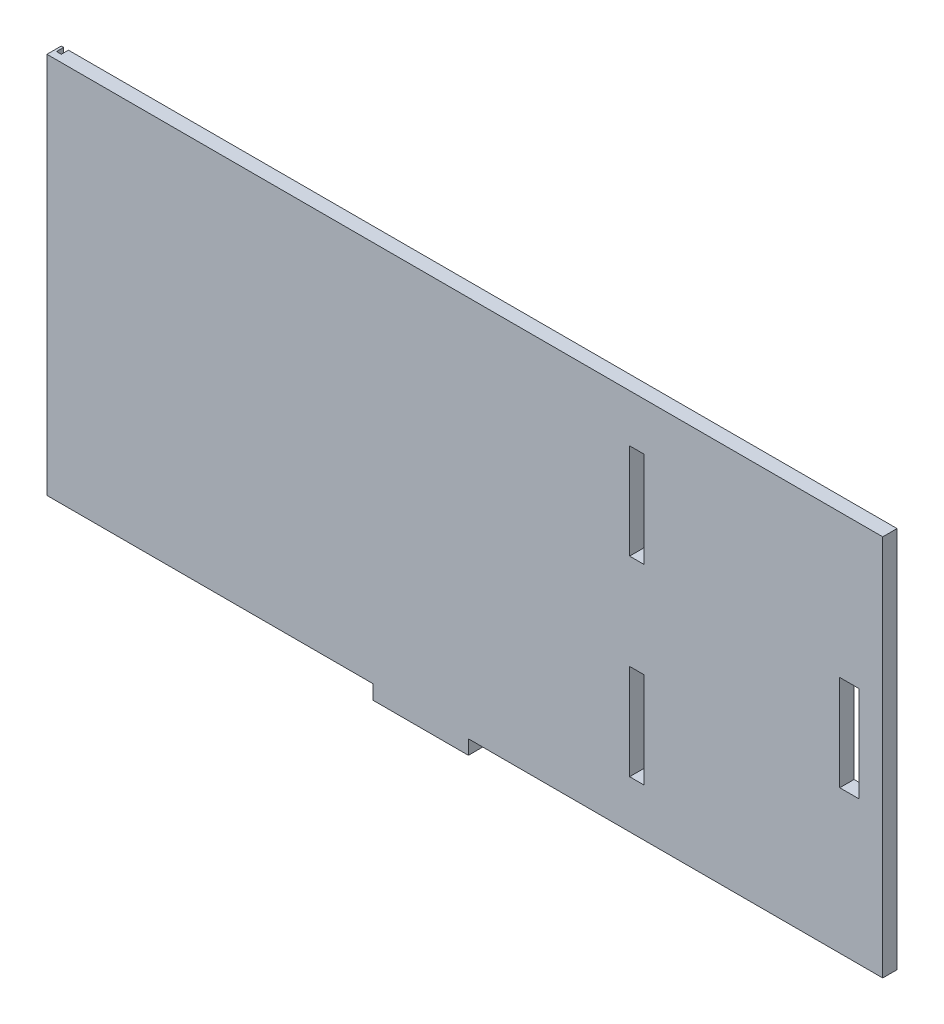
from build123d import *

# Parameters (mm, degrees)
ESQUISSE2_W             = 175
ESQUISSE2_H             = 80
BOSS_EXTRU_2_DEPTH      = 3
ENL_V_MAT_EXTRU_1_REACH = 194.442
ESQUISSE3_W             = 3
ESQUISSE3_H             = 20
ENL_V_MAT_EXTRU_2_REACH = 194.442
ESQUISSE4_W             = 1
ESQUISSE4_H             = 1.5
ESQUISSE5_W             = 20
ESQUISSE5_H             = 3
BOSS_EXTRU_3_DEPTH      = 3
ESQUISSE6_W             = 4
ESQUISSE6_H             = 20
ENL_V_MAT_EXTRU_3_DEPTH = 10


with BuildPart() as part:
    # Esquisse2 → Boss.-Extru.2 (new body)
    with BuildSketch(Plane.XY):
        with Locations((-87.5, -40)):
            Rectangle(ESQUISSE2_W, ESQUISSE2_H)
    extrude(amount=BOSS_EXTRU_2_DEPTH)

    # Esquisse3 → Enlèv. mat.-Extru.1 (cut, up to next)
    with BuildSketch(Plane.XY.offset(3), mode=Mode.PRIVATE) as enl_v_mat_extru_1_sk1:
        with Locations((-51.5, -60)):
            Rectangle(ESQUISSE3_W, ESQUISSE3_H)
    enl_v_mat_extru_1_tool1 = extrude(enl_v_mat_extru_1_sk1.sketch, amount=-ENL_V_MAT_EXTRU_1_REACH, mode=Mode.PRIVATE) & part.part
    # Esquisse3 → Enlèv. mat.-Extru.1 (cut, up to next)
    with BuildSketch(Plane.XY.offset(3), mode=Mode.PRIVATE) as enl_v_mat_extru_1_sk2:
        with Locations((-51.5, -20)):
            Rectangle(ESQUISSE3_W, ESQUISSE3_H)
    enl_v_mat_extru_1_tool2 = extrude(enl_v_mat_extru_1_sk2.sketch, amount=-ENL_V_MAT_EXTRU_1_REACH, mode=Mode.PRIVATE) & part.part
    add(enl_v_mat_extru_1_tool1.solids().sort_by_distance((-51.5, -60, 3))[0], mode=Mode.SUBTRACT)
    add(enl_v_mat_extru_1_tool2.solids().sort_by_distance((-51.5, -20, 3))[0], mode=Mode.SUBTRACT)

    # Esquisse4 → Enlèv. mat.-Extru.2 (cut, up to next)
    with BuildSketch(Plane(origin=(0, 0, 0), x_dir=(1, 0, 0), z_dir=(0, 1, 0)), mode=Mode.PRIVATE) as enl_v_mat_extru_2_sk1:
        with Locations((-174, -0.75)):
            Rectangle(ESQUISSE4_W, ESQUISSE4_H)
    enl_v_mat_extru_2_tool1 = extrude(enl_v_mat_extru_2_sk1.sketch, amount=-ENL_V_MAT_EXTRU_2_REACH, mode=Mode.PRIVATE) & part.part
    add(enl_v_mat_extru_2_tool1.solids().sort_by_distance((-174, 0, 0.75))[0], mode=Mode.SUBTRACT)

    # Esquisse5 → Boss.-Extru.3 (add)
    with BuildSketch(Plane(origin=(0, -80, 0), x_dir=(-1, 0, 0), z_dir=(0, -1, 0))):
        with Locations((96.75, -1.5)):
            Rectangle(ESQUISSE5_W, ESQUISSE5_H)
    extrude(amount=BOSS_EXTRU_3_DEPTH)

    # Esquisse6 → Enlèv. mat.-Extru.3 (cut)
    with BuildSketch(Plane(origin=(0, 0, 0), x_dir=(-1, 0, 0), z_dir=(0, 0, -1))):
        with Locations((7, -40)):
            Rectangle(ESQUISSE6_W, ESQUISSE6_H)
    extrude(amount=-ENL_V_MAT_EXTRU_3_DEPTH, mode=Mode.SUBTRACT)


solid = part.part
